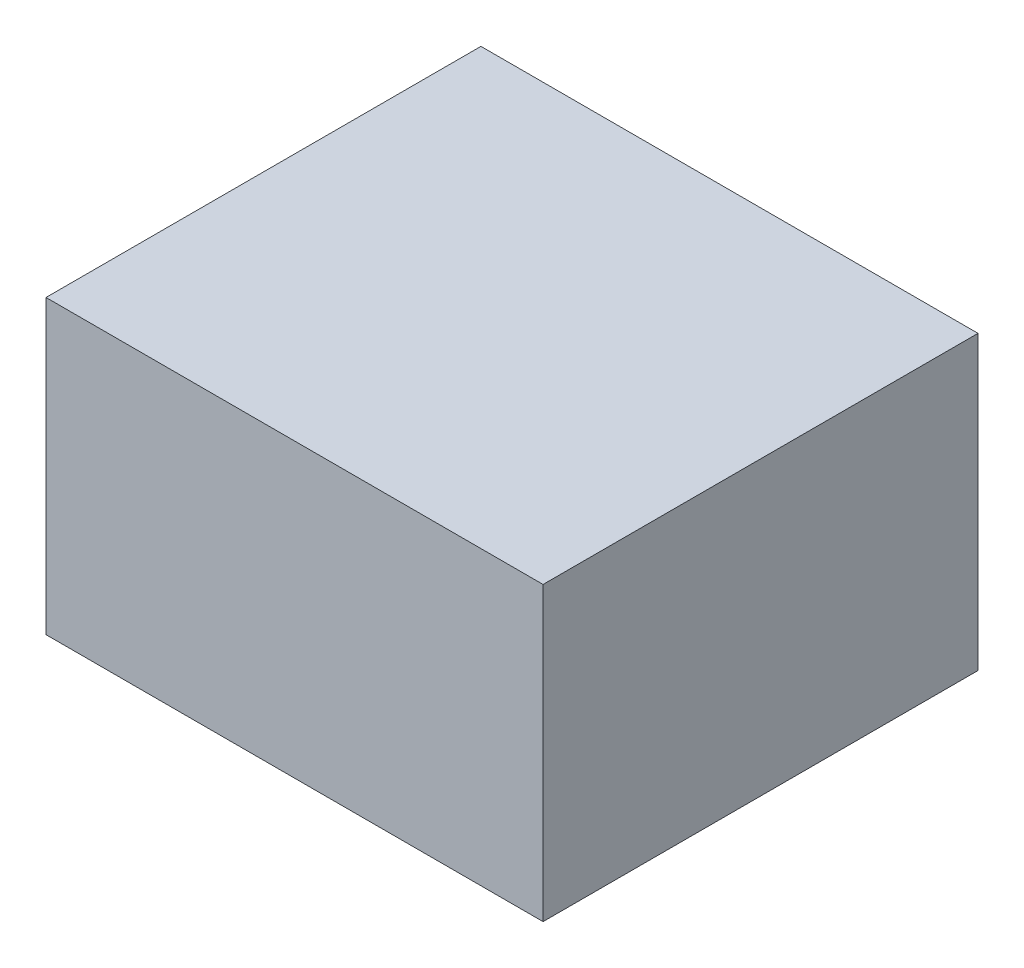
from build123d import *

# Parameters (mm, degrees)
ESQUISSE1_W        = 8
ESQUISSE1_H        = 4.7
BOSS_EXTRU_1_DEPTH = 7


with BuildPart() as part:
    # Esquisse1 → Boss.-Extru.1 (new body)
    with BuildSketch(Plane.XY):
        with Locations((-4, 2.35)):
            Rectangle(ESQUISSE1_W, ESQUISSE1_H)
    extrude(amount=BOSS_EXTRU_1_DEPTH)


solid = part.part
